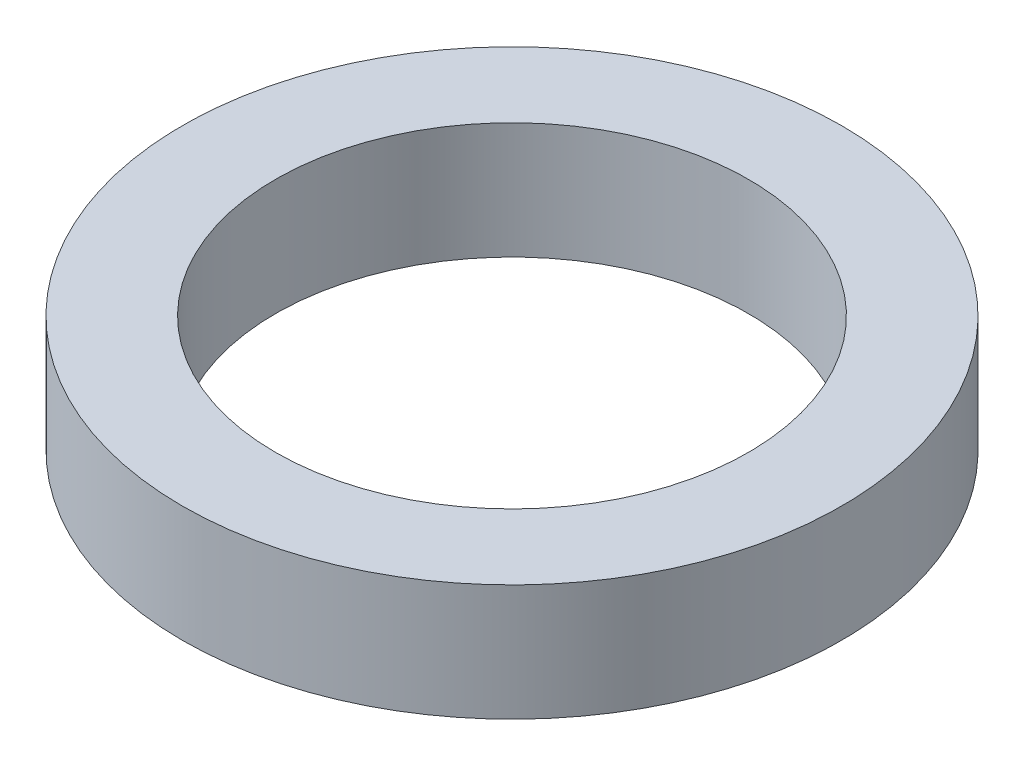
from build123d import *

# Parameters (mm, degrees)
SPACER_RING_SKETCH_R   = 8.5
SPACER_RING_SKETCH_R_2 = 6.1
SPACER_RING_DEPTH      = 3


with BuildPart() as part:
    # Spacer ring sketch → Spacer ring (new body)
    with BuildSketch(Plane(origin=(0, -136, 0), x_dir=(1, 0, 0), z_dir=(0, 1, 0))):
        with Locations(Location((-56.291651246, 0, 0), (0, 0, 270))):
            Circle(SPACER_RING_SKETCH_R)
        with Locations(Location((-56.291651246, 0, 0), (0, 0, 270))):
            Circle(SPACER_RING_SKETCH_R_2, mode=Mode.SUBTRACT)
    extrude(amount=SPACER_RING_DEPTH)


solid = part.part
